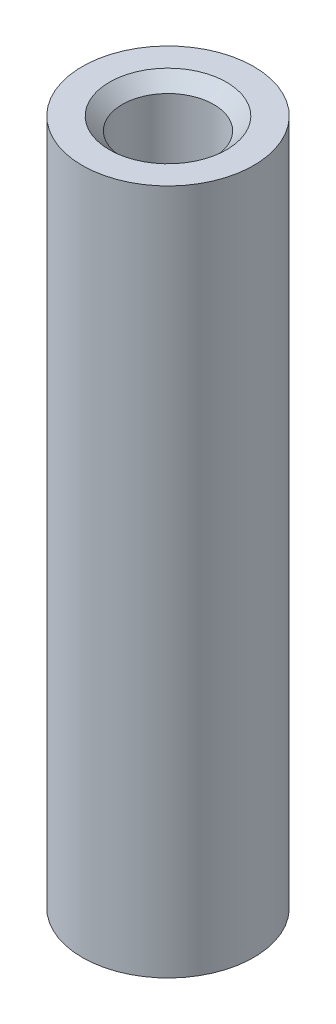
from build123d import *

# Parameters (mm, degrees)
SKETCH_1_R                   = 1.5
EXTRUDE_1_DEPTH              = 12
HOLE_WIZARD_M2_1_D           = 1.6
HOLE_WIZARD_M2_1_DEPTH       = 16
HOLE_WIZARD_M2_1_CSINK_D     = 2.05
HOLE_WIZARD_M2_1_CSINK_ANGLE = 90
HOLE_WIZARD_M2_1_TIP         = 0.480688495


with BuildPart() as part:
    # 草图1 → 凸台-拉伸1 (new body)
    with BuildSketch(Plane(origin=(0, 0, 0), x_dir=(1, 0, 0), z_dir=(0, 1, 0))):
        with Locations(Location((0, 0, 0), (0, 0, 270))):
            Circle(SKETCH_1_R)
    extrude(amount=EXTRUDE_1_DEPTH)

    # M2 螺纹孔1
    with Locations(Plane(origin=(0, 12, 0), x_dir=(1, 0, 0), z_dir=(0, 1, 0))):
        with Locations((0, 0)):
            CounterSinkHole(HOLE_WIZARD_M2_1_D / 2, HOLE_WIZARD_M2_1_CSINK_D / 2, depth=HOLE_WIZARD_M2_1_DEPTH, counter_sink_angle=HOLE_WIZARD_M2_1_CSINK_ANGLE)
            with Locations((0, 0, -(HOLE_WIZARD_M2_1_DEPTH + HOLE_WIZARD_M2_1_TIP / 2))):  # 118° drill point
                Cone(0, HOLE_WIZARD_M2_1_D / 2, HOLE_WIZARD_M2_1_TIP, mode=Mode.SUBTRACT)


solid = part.part
